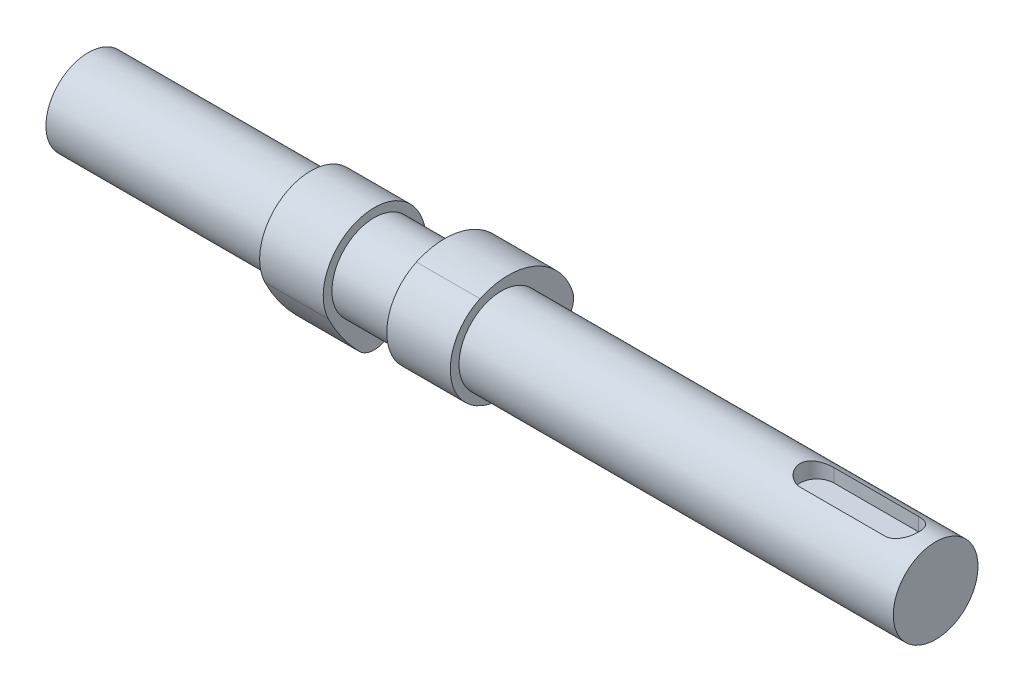
from build123d import *

# Parameters (mm, degrees)
BOSS_EXTRUDE1_DEPTH      = 125
BOSS_EXTRUDE1_DEPTH_BACK = 75
SKETCH1_R                = 10
BOSS_EXTRUDE2_START      = 15
BOSS_EXTRUDE2_DEPTH      = 7.5
BODY_MOVE_COPY1_ANGLE    = 90
CUT_EXTRUDE1_DEPTH       = 4


with BuildPart() as part:
    # Sketch1 → Boss-Extrude1 (new, two sides: drawn at the far end of the back side and taken through both)
    with BuildSketch(Plane(origin=(0, 0, 0), x_dir=(0, 0, -1), z_dir=(1, 0, 0)).offset(-BOSS_EXTRUDE1_DEPTH_BACK)):
        Circle(SKETCH1_R)
    extrude(amount=BOSS_EXTRUDE1_DEPTH + BOSS_EXTRUDE1_DEPTH_BACK)

    # Sketch3 → Cut-Extrude1 (cut)
    with BuildSketch(Plane(origin=(0, 10, 0), x_dir=(1, 0, 0), z_dir=(0, 1, 0))):
        with BuildLine():
            Line((117, -4), (97, -4))
            ThreePointArc((97, -4), (93, 0), (97, 4))
            Line((97, 4), (117, 4))
            ThreePointArc((117, 4), (121, 0), (117, -4))
        make_face()
    extrude(amount=-CUT_EXTRUDE1_DEPTH, mode=Mode.SUBTRACT)


with BuildPart() as body_2:
    # Sketch2 → Boss-Extrude2 (new, symmetric)
    with BuildSketch(Plane(origin=(0, 0, 0), x_dir=(0, 0, -1), z_dir=(1, 0, 0)).offset(BOSS_EXTRUDE2_START)):
        with BuildLine():
            ThreePointArc((-5.046602678, 10.944961822), (-10.875073876, -5.195493822), (5.343417372, -10.803160586))
            ThreePointArc((5.343417372, -10.803160586), (10.727783283, -7.591855887), (15.544249573, -3.578686737))
            ThreePointArc((15.544249573, -3.578686737), (16.91745458, -1.15380281), (16.779427438, 1.62948707))
            ThreePointArc((16.779427438, 1.62948707), (7.933695414, 11.130840359), (-5.046602678, 10.944961822))
        make_face()
    extrude(amount=BOSS_EXTRUDE2_DEPTH, both=True)


with BuildPart() as body_3:
    # Mirror1: mirrored copy
    add(body_2.part.mirror(Plane(origin=(0, 0, 0), x_dir=(0, 0, 1), z_dir=(1, 0, 0))))


with BuildPart() as body_3_1:
    # Body-Move/Copy1: moved
    add(body_3.part.rotate(Axis((0, 0, 0), (-1, 0, 0)), BODY_MOVE_COPY1_ANGLE))


solid = Compound([part.part, body_2.part, body_3_1.part])
